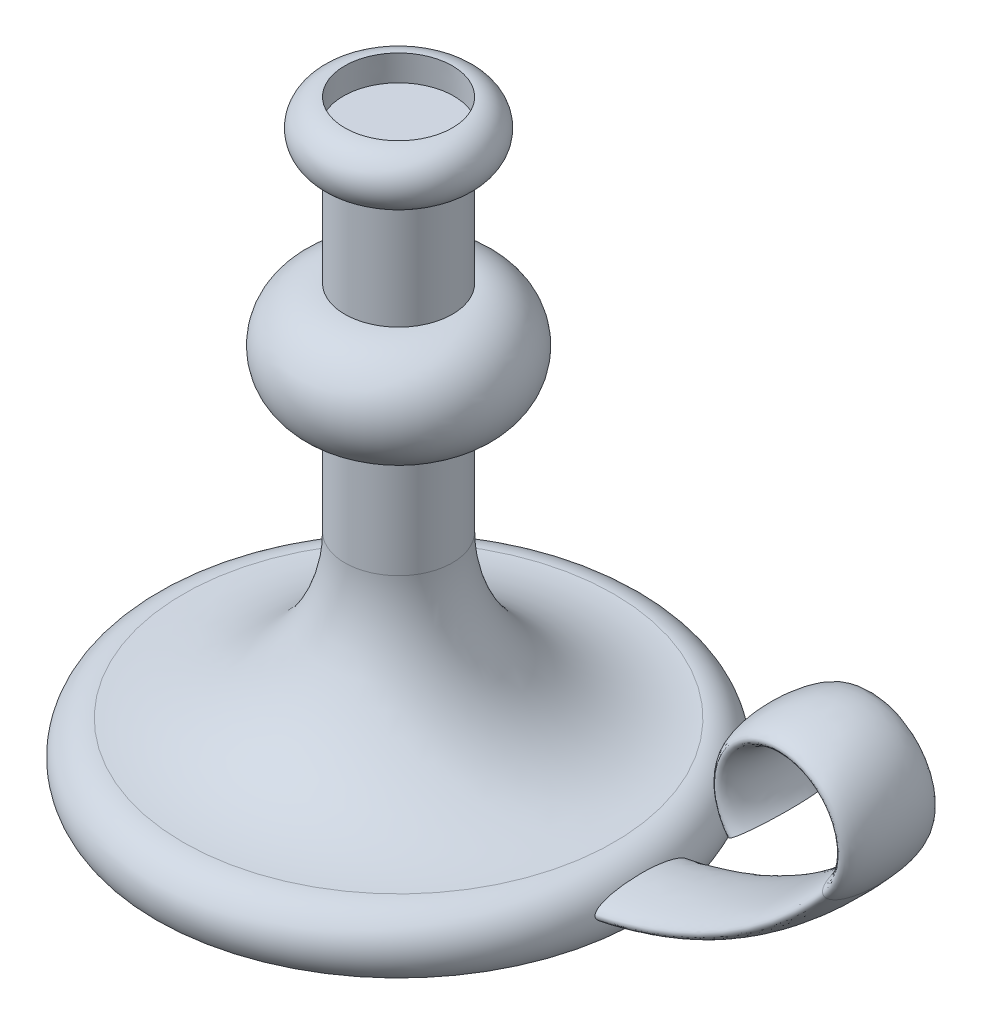
from build123d import *

# Parameters (mm, degrees)
SKETCH4_RX         = 17.5
SKETCH4_RY         = 5
SKETCH5_R          = 20
CUT_EXTRUDE1_DEPTH = 10
CUT_EXTRUDE1_DRAFT = 3


with BuildPart() as part:
    # Sketch1 → Revolve1 (revolve)
    with BuildSketch(Plane.XY, mode=Mode.PRIVATE) as revolve1_sk:
        with BuildLine():
            Line((0, 0), (-90, 0))
            Line((-90, 0), (-90, 220))
            Line((-90, 220), (-70, 220))
            ThreePointArc((-70, 220), (-60, 210), (-70, 200))
            Line((-70, 200), (-70, 160))
            ThreePointArc((-70, 160), (-50, 140), (-70, 120))
            Line((-70, 120), (-70, 80))
            ThreePointArc((-70, 80), (-52.426406871, 37.573593129), (-10, 20))
            ThreePointArc((-10, 20), (1.180339887, 13.090169944), (0, 0))
        make_face()
    revolve(revolve1_sk.sketch.rotate(Axis((-90, 0, 0), (0, 1, 0)), 90), axis=Axis((-90, 0, 0), (0, 1, 0)))

    # Sweep1: sweep along a path in Sketch2
    with BuildLine(Plane.XY) as sweep1_path:
        ThreePointArc((0, 13.030615433), (45.797489485, 30.559895752), (83.494128305, 61.923076923))
        ThreePointArc((83.494128305, 61.923076923), (68.361577865, 95), (53.229027424, 61.923076923))
    # Sketch4 → Sweep1 (sweep)
    with BuildSketch(Plane(origin=(0, 0, 0), x_dir=(0, 0, -1), z_dir=(1, 0, 0))):
        with Locations(Location((0, 10), (0, 0, 180))):
            Ellipse(SKETCH4_RX, SKETCH4_RY)
    sweep(path=sweep1_path.line)


with BuildPart() as cut_extrude1_tool:
    # Sketch5 → Cut-Extrude1 (with draft: the straight prism first)
    with BuildSketch(Plane(origin=(0, 220, 0), x_dir=(1, 0, 0), z_dir=(0, 1, 0))):
        with Locations(Location((-90, 0, 0), (0, 0, 90))):
            Circle(SKETCH5_R)
    extrude(amount=-CUT_EXTRUDE1_DEPTH)
    # Cut-Extrude1: the draft: its side faces are tilted about the plane it starts from
    cut_extrude1_sides = [cut_extrude1_tool.faces().sort_by_distance(p)[0] for p in [
        (-90, 215, 20),
    ]]
    draft(cut_extrude1_sides, Plane(origin=(0, 220, 0), x_dir=(1, 0, 0), z_dir=(0, 1, 0)), CUT_EXTRUDE1_DRAFT)


with BuildPart() as part_1:
    add(part.part)

    # Cut-Extrude1: cut by cut_extrude1_tool
    add(cut_extrude1_tool.part, mode=Mode.SUBTRACT)


solid = part_1.part
